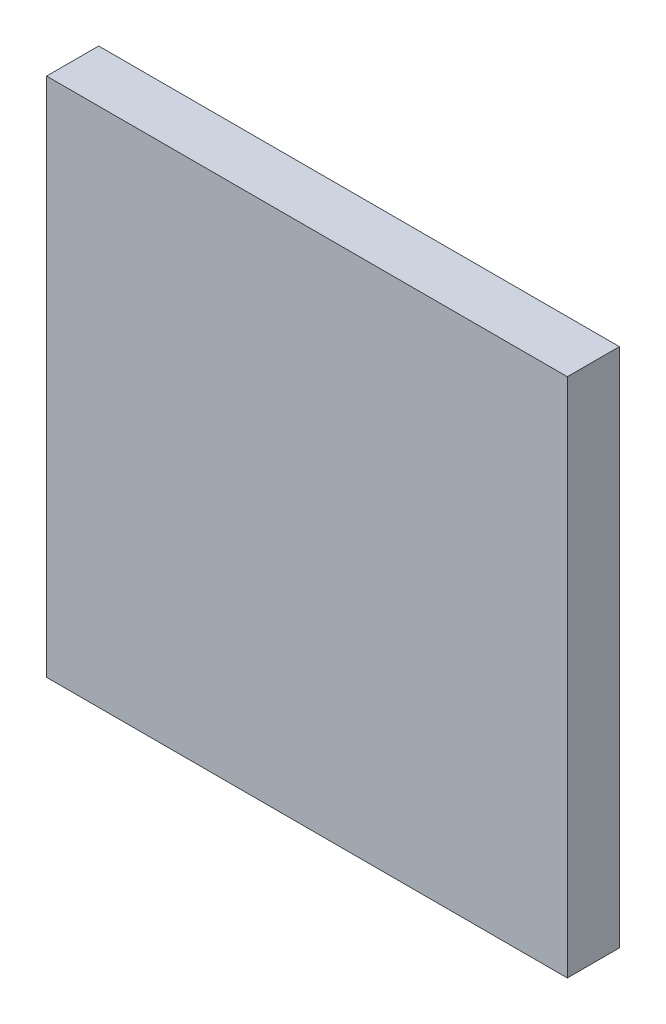
from build123d import *

# Parameters (mm, degrees)
SKETCH_259_W      = 500
SKETCH_259_H      = 500
EXTRUDE_603_DEPTH = 50


with BuildPart() as part:
    # Sketch 259 → Extrude 603 (new body)
    with BuildSketch(Plane.XY):
        Rectangle(SKETCH_259_W, SKETCH_259_H)
    extrude(amount=-EXTRUDE_603_DEPTH)


solid = part.part
